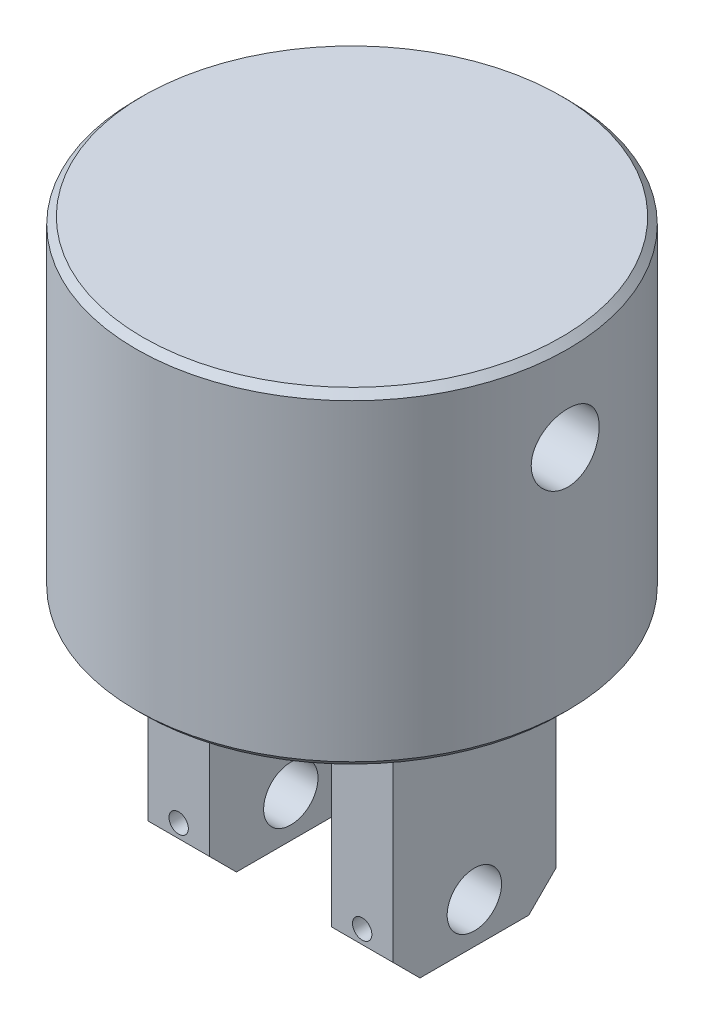
from build123d import *

# Parameters (mm, degrees)
BOSS_EXTRUDE1_DEPTH         = 19.05
SKETCH2_R                   = 3.175
CUT_EXTRUDE1_DEPTH          = 42.790767895
CHAMFER1_SIZE               = 3.175
SKETCH3_R                   = 25.2095
BOSS_EXTRUDE2_DEPTH         = 38.1
CHAMFER2_SIZE               = 0.79375
F_4_40_TAPPED_HOLE1_REACH   = 77.334
F_4_40_TAPPED_HOLE1_BORE_R  = 1.1303
F_3_8_16_TAPPED_HOLE1_D     = 7.9375
F_3_8_16_TAPPED_HOLE1_DEPTH = 25.4
F_3_8_16_TAPPED_HOLE1_TIP   = 2.384665582


with BuildPart() as part:
    # Sketch1 → Boss-Extrude1 (new body)
    with BuildSketch(Plane.XY):
        Polygon((-7.14375, 15.875), (-7.14375, -4.7625), (-14.2875, -4.7625), (-14.2875, 23.8125), (14.2875, 23.8125), (14.2875, -4.7625), (7.14375, -4.7625), (7.14375, 15.875), align=None)
    extrude(amount=BOSS_EXTRUDE1_DEPTH)

    # Sketch2 → Cut-Extrude1 (cut, through all)
    with BuildSketch(Plane(origin=(14.2875, 0, 0), x_dir=(0, 0, -1), z_dir=(1, 0, 0))):
        with Locations((-9.525, 0)):
            Circle(SKETCH2_R)
    extrude(amount=-CUT_EXTRUDE1_DEPTH, mode=Mode.SUBTRACT)

    # Chamfer1
    chamfer1_edges = [part.edges().sort_by_distance(p)[0] for p in [
        (10.715625, -4.7625, 19.05),
        (-10.715625, -4.7625, 19.05),
        (-10.715625, -4.7625, 0),
        (10.715625, -4.7625, 0),
    ]]
    chamfer(chamfer1_edges, length=CHAMFER1_SIZE)

    # Sketch3 → Boss-Extrude2 (add)
    with BuildSketch(Plane(origin=(0, 23.8125, 0), x_dir=(1, 0, 0), z_dir=(0, 1, 0))):
        with Locations(Location((0, -9.525, 0), (0, 0, 90))):
            Circle(SKETCH3_R)
    extrude(amount=BOSS_EXTRUDE2_DEPTH)

    # Chamfer2
    chamfer2_edges = [part.edges().sort_by_distance(p)[0] for p in [
        (0, 23.8125, 34.7345),
        (0, 61.9125, 34.7345),
    ]]
    chamfer(chamfer2_edges, length=CHAMFER2_SIZE)

    # #4-40 Tapped Hole1 bore → #4-40 Tapped Hole1 (cut, up to next)
    with BuildSketch(Plane.XY.offset(19.05), mode=Mode.PRIVATE) as f_4_40_tapped_hole1_sk1:
        with Locations((-10.715625, 0)):
            Circle(F_4_40_TAPPED_HOLE1_BORE_R)
    f_4_40_tapped_hole1_tool1 = extrude(f_4_40_tapped_hole1_sk1.sketch, amount=-F_4_40_TAPPED_HOLE1_REACH, mode=Mode.PRIVATE) & part.part
    # #4-40 Tapped Hole1 bore → #4-40 Tapped Hole1 (cut, up to next)
    with BuildSketch(Plane.XY.offset(19.05), mode=Mode.PRIVATE) as f_4_40_tapped_hole1_sk2:
        with Locations((10.715625, 0)):
            Circle(F_4_40_TAPPED_HOLE1_BORE_R)
    f_4_40_tapped_hole1_tool2 = extrude(f_4_40_tapped_hole1_sk2.sketch, amount=-F_4_40_TAPPED_HOLE1_REACH, mode=Mode.PRIVATE) & part.part
    add(f_4_40_tapped_hole1_tool1.solids().sort_by_distance((-10.715625, 0, 19.05))[0], mode=Mode.SUBTRACT)
    add(f_4_40_tapped_hole1_tool2.solids().sort_by_distance((10.715625, 0, 19.05))[0], mode=Mode.SUBTRACT)

    # 3/8-16 Tapped Hole1
    with Locations(Plane(origin=(25.2095, 0, 0), x_dir=(0, 0, -1), z_dir=(1, 0, 0))):
        with Locations((-9.525, 51.1429)):
            Hole(F_3_8_16_TAPPED_HOLE1_D / 2, depth=F_3_8_16_TAPPED_HOLE1_DEPTH)
            with Locations((0, 0, -(F_3_8_16_TAPPED_HOLE1_DEPTH + F_3_8_16_TAPPED_HOLE1_TIP / 2))):  # 118° drill point
                Cone(0, F_3_8_16_TAPPED_HOLE1_D / 2, F_3_8_16_TAPPED_HOLE1_TIP, mode=Mode.SUBTRACT)


solid = part.part
